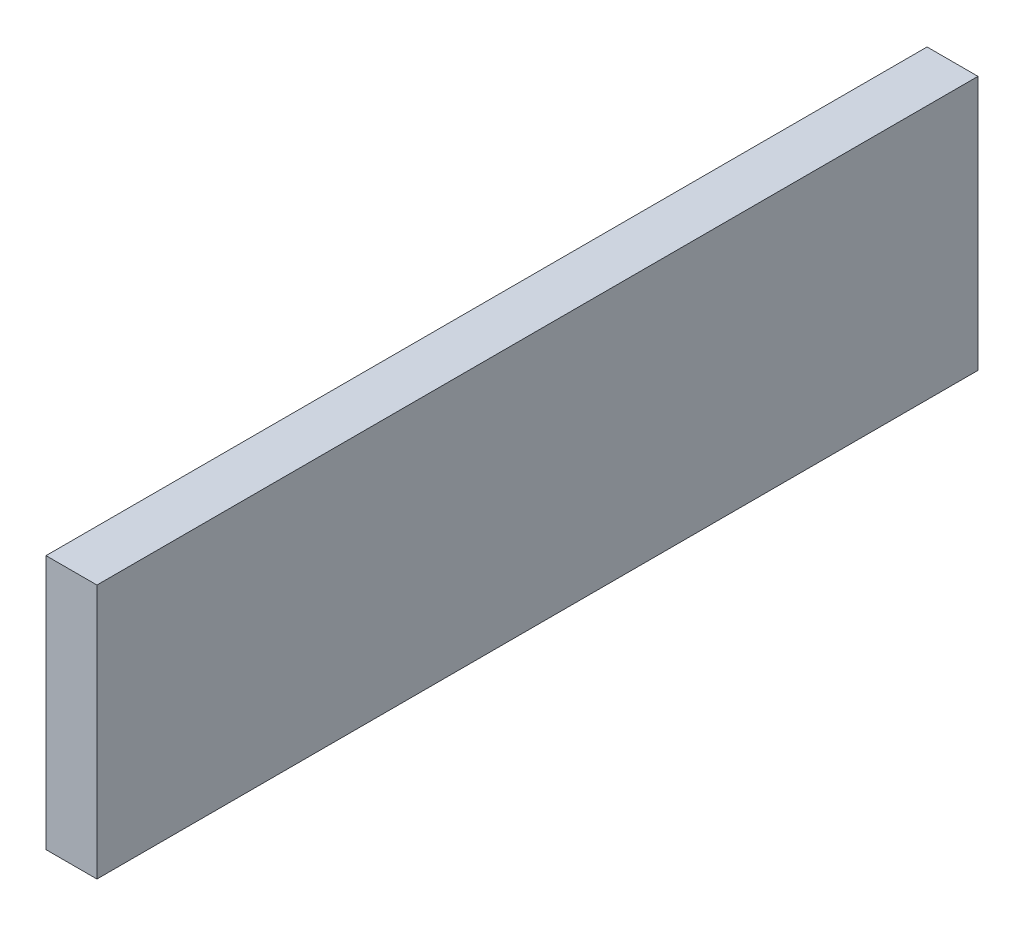
from build123d import *

# Parameters (mm, degrees)
SKETCH_1_W      = 20
SKETCH_1_H      = 346
EXTRUDE_1_DEPTH = 100


with BuildPart() as part:
    # 草图1 → 凸台-拉伸1 (new body)
    with BuildSketch(Plane(origin=(0, 0, 0), x_dir=(1, 0, 0), z_dir=(0, 1, 0))):
        with Locations((10, -173)):
            Rectangle(SKETCH_1_W, SKETCH_1_H)
    extrude(amount=EXTRUDE_1_DEPTH)


solid = part.part
